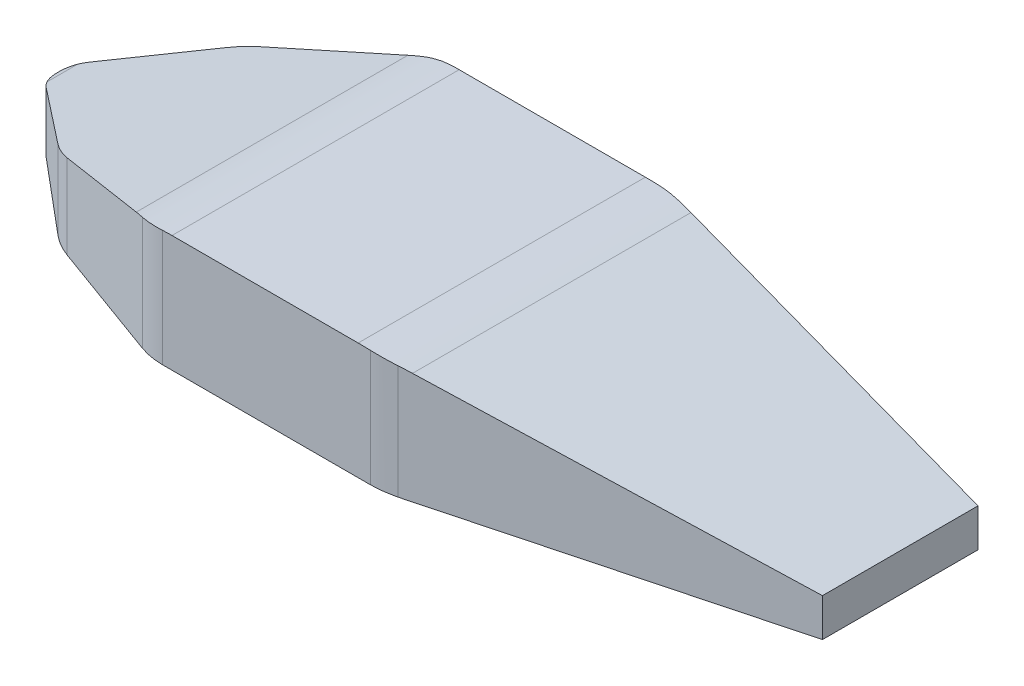
from build123d import *

# Parameters (mm, degrees)
TOPVIEW_EXTRUDE_DEPTH      = 800
SIDEPROFILE_CUT_DEPTH      = 4914.47877429
SIDEPROFILE_CUT_DEPTH_BACK = 4914.47877429
SKETCH2_OUTSIDE_W          = 5698.923
SKETCH2_OUTSIDE_H          = 1806.388


with BuildPart() as part:
    # Sketch1 → TopView_Extrude (new body)
    with BuildSketch(Plane(origin=(0, 0, 0), x_dir=(1, 0, 0), z_dir=(0, 1, 0))):
        with BuildLine():
            Line((146.069849076, 122.567124227), (556.148324977, 466.663731547))
            ThreePointArc((556.148324977, 466.663731547), (613.263316637, 506.656075273), (676.455195963, 536.122941687))
            Line((676.455195963, 536.122941687), (1335.173700718, 775.877020708))
            ThreePointArc((1335.173700718, 775.877020708), (1402.522523085, 793.923094197), (1471.981833896, 800))
            Line((1471.981833896, 800), (2631.460091708, 800))
            ThreePointArc((2631.460091708, 800), (2701.184663634, 796.955760422), (2770.378589806, 787.846210174))
            Line((2770.378589806, 787.846210174), (4781.451, 433.24))
            Line((4781.451, 433.24), (4781.451, -433.24))
            Line((4781.451, -433.24), (2770.378589806, -787.846210174))
            ThreePointArc((2770.378589806, -787.846210174), (2701.184663634, -796.955760422), (2631.460091708, -800))
            Line((2631.460091708, -800), (1471.981833896, -800))
            ThreePointArc((1471.981833896, -800), (1402.522523085, -793.923094197), (1335.173700718, -775.877020708))
            Line((1335.173700718, -775.877020708), (676.455195963, -536.122941687))
            ThreePointArc((676.455195963, -536.122941687), (613.263316637, -506.656075273), (556.148324977, -466.663731547))
            Line((556.148324977, -466.663731547), (146.069849076, -122.567124227))
            ThreePointArc((146.069849076, -122.567124227), (88.915850742, 0), (146.069849076, 122.567124227))
        make_face()
    extrude(amount=TOPVIEW_EXTRUDE_DEPTH)

    # Sketch2 outside → SideProfile_Cut (cut, two sides: drawn at the far end of the back side and taken through both)
    with BuildSketch(Plane.XY.offset(-SIDEPROFILE_CUT_DEPTH_BACK)):
        with Locations((2435.1835, 400)):
            Rectangle(SKETCH2_OUTSIDE_W, SKETCH2_OUTSIDE_H)
        with BuildLine():
            Line((0, 300), (0, 332.854125267))
            ThreePointArc((0, 332.854125267), (31.780430043, 425.180358155), (113.65511039, 478.384359237))
            Line((113.65511039, 478.384359237), (1282.133703367, 770.201559797))
            ThreePointArc((1282.133703367, 770.201559797), (1402.370605908, 792.522432945), (1524.432967436, 800))
            Line((1524.432967436, 800), (2561.597345878, 800))
            ThreePointArc((2561.597345878, 800), (2701.110323381, 795.128098421), (2839.943607388, 780.536129108))
            Line((2839.943607388, 780.536129108), (4781.451, 507.675))
            Line((4781.451, 507.675), (4781.451, 295.448))
            Line((4781.451, 295.448), (2805.958277636, 157.307872364))
            ThreePointArc((2805.958277636, 157.307872364), (2701.387181329, 151.827524732), (2596.688525433, 150))
            Line((2596.688525433, 150), (150, 150))
            ThreePointArc((150, 150), (43.933982822, 193.933982822), (0, 300))
        make_face(mode=Mode.SUBTRACT)
    extrude(amount=SIDEPROFILE_CUT_DEPTH + SIDEPROFILE_CUT_DEPTH_BACK, mode=Mode.SUBTRACT)


solid = part.part
